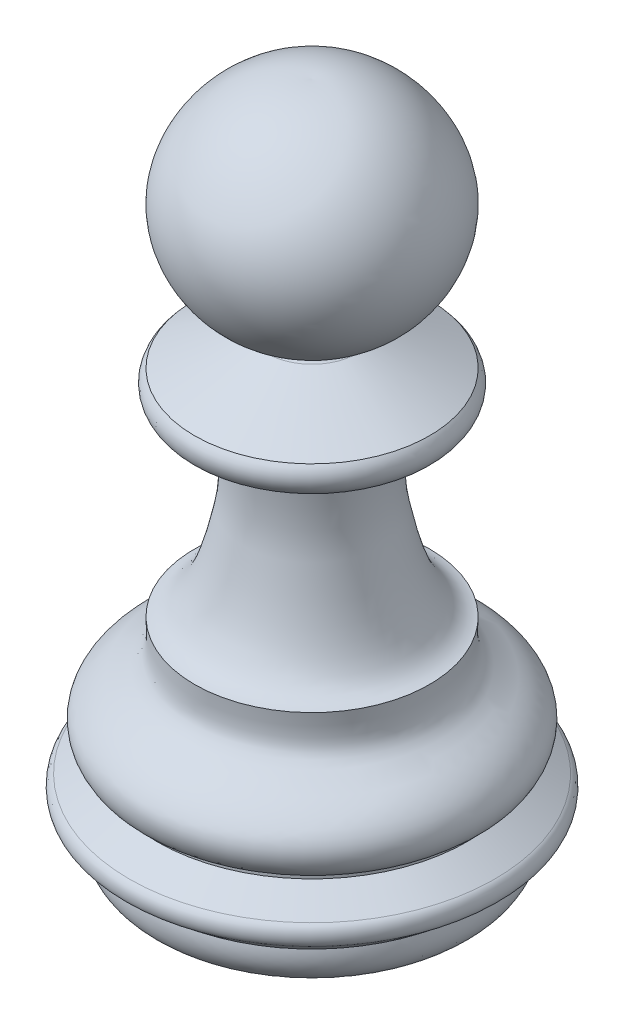
from build123d import *

# Parameters (mm, degrees)
CONG_1_R = 0.2
CONG_2_R = 0.5
CONG_3_R = 0.18


with BuildPart() as part:
    # Esquisse1 → Révolution1 (revolve)
    with BuildSketch(Plane.XY, mode=Mode.PRIVATE) as r_volution1_sk:
        with BuildLine():
            Line((117.15, 0), (122.689076716, 0))
            add(Edge.make_bspline(
                [(122.689076716, 0), (123.720180188, 0.413269006), (123.507497703, 1.498874753)],
                knots=[0, 0, 0, 1, 1, 1], degree=2))
            Line((123.507497703, 1.498874753), (124.41997005, 2.230636669))
            add(Edge.make_bspline(
                [(124.41997005, 2.230636669), (124.424970044, 2.23464644), (124.524969931, 2.314841866), (124.599258114, 2.637784093), (124.466950359, 2.911826353), (124.351303215, 2.986294994), (124.345520858, 2.990018426)],
                knots=[0, 0, 0, 0, 0.024882627, 0.497652548, 0.974882627, 1, 1, 1, 1], degree=3))
            Line((124.345520858, 2.990018426), (123.240177492, 3.701781943))
            Line((123.240177492, 3.701781943), (123.240177492, 3.916266358))
            add(Edge.make_bspline(
                [(123.240177492, 3.916266358), (123.723083146, 3.991253669), (124.306653388, 5.101742284), (123.081672795, 6.265997879), (121.685037398, 6.837804693), (121.752034726, 7.830076406), (121.77402376, 8.334862529)],
                knots=[0, 0, 0, 0, 0.244963247, 0.538873498, 0.805631519, 1, 1, 1, 1], degree=3))
            add(Edge.make_bspline(
                [(121.77402376, 8.334862529), (121.325189709, 8.42387781), (120.554441223, 9.164733704), (120.0965785, 10.981834086), (119.831852035, 12.257619942), (119.61389338, 13.366234277), (119.919538358, 15.676913328)],
                knots=[0, 0, 0, 0, 0.213512712, 0.653955017, 0.738109275, 1, 1, 1, 1], degree=3))
            Line((119.919538358, 15.676913328), (121.509349383, 15.676913328))
            add(Edge.make_bspline(
                [(121.509349383, 15.676913328), (121.516240301, 15.676913328), (121.654058656, 15.676913328), (122.062118222, 16.060192072), (122.018502114, 16.552678442), (121.77402376, 16.813845947)],
                knots=[0, 0, 0, 0, 0.015325754, 0.306515076, 1, 1, 1, 1], degree=3))
            Line((121.77402376, 16.813845947), (118.834523645, 18.251811206))
            Line((118.834523645, 18.251811206), (118.834523645, 18.534833536))
            add(Edge.make_bspline(
                [(118.834523645, 18.534833536), (120.524912645, 18.970684443), (122.773650121, 22.064326319), (120.403758441, 26.012670992), (118.129533272, 26.733937399), (117.15, 26.670376928)],
                knots=[0, 0, 0, 0, 0.437276396, 0.756810174, 1, 1, 1, 1], degree=3))
            Line((117.15, 26.670376928), (117.15, 0))
        make_face()
    revolve(r_volution1_sk.sketch.rotate(Axis((117.15, 26.670376928, 0), (0, -1, 0)), 90), axis=Axis((117.15, 26.670376928, 0), (0, -1, 0)))

    # Congé1
    cong_1_edges = [part.edges().sort_by_distance(p)[0] for p in [
        (117.15, 18.534833536, -1.684523645),
    ]]
    fillet(cong_1_edges, radius=CONG_1_R)

    # Congé2
    cong_2_edges = [part.edges().sort_by_distance(p)[0] for p in [
        (117.15, 15.676913328, -2.769538358),
    ]]
    fillet(cong_2_edges, radius=CONG_2_R)

    # Congé3
    cong_3_edges = [part.edges().sort_by_distance(p)[0] for p in [
        (117.15, 18.251811206, -1.684523645),
    ]]
    fillet(cong_3_edges, radius=CONG_3_R)


solid = part.part
